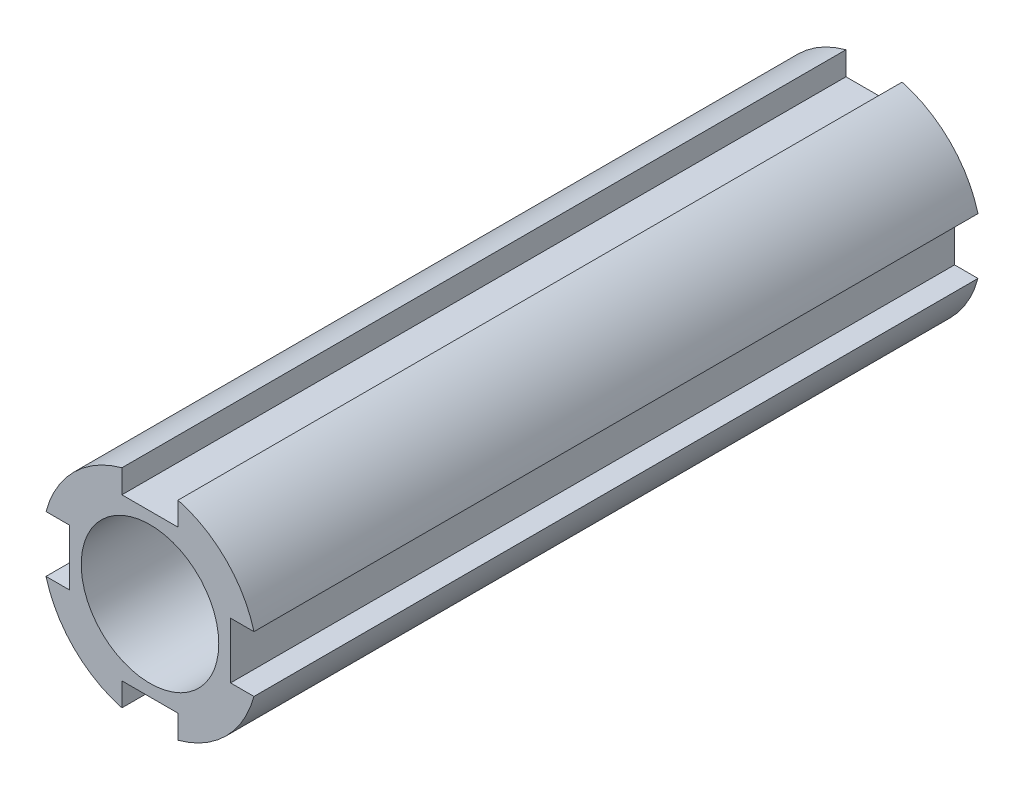
from build123d import *

# Parameters (mm, degrees)
SKETCH1_R           = 5.95
BOSS_EXTRUDE2_DEPTH = 20
CUT_EXTRUDE1_DEPTH  = 41.875481649
CUT_EXTRUDE3_DEPTH  = 41.875481649
SKETCH10_R          = 3.8
CUT_EXTRUDE4_DEPTH  = 8
FILLET2_R           = 0.25


with BuildPart() as part:
    # Sketch1 → Boss-Extrude2 (new, symmetric)
    with BuildSketch(Plane.XY):
        Circle(SKETCH1_R)
    extrude(amount=BOSS_EXTRUDE2_DEPTH, both=True)

    # Sketch8 → Cut-Extrude1 (cut, through all)
    with BuildSketch(Plane.XY.offset(20)):
        Polygon((1.1, 1.05), (2.4, 1.05), (2.4, -1.05), (1.1, -1.05), (1.1, -2.35), (-1, -2.35), (-1, -1.05), (-2.3, -1.05), (-2.3, 1.05), (-1, 1.05), (-1, 2.35), (1.1, 2.35), align=None)
    extrude(amount=-CUT_EXTRUDE1_DEPTH, mode=Mode.SUBTRACT)

    # Sketch9 → Cut-Extrude3 (cut, through all)
    with BuildSketch(Plane.XY.offset(20)):
        with BuildLine():
            ThreePointArc((1.55, 5.744562647), (0, 5.95), (-1.55, 5.744562647))
            Line((-1.55, 5.744562647), (-1.55, 4.45))
            Line((-1.55, 4.45), (1.55, 4.45))
            Line((1.55, 4.45), (1.55, 5.744562647))
        make_face()
        with BuildLine():
            ThreePointArc((5.95, 0), (5.898417065, 0.781777543), (5.744562647, 1.55))
            Line((5.744562647, 1.55), (4.45, 1.55))
            Line((4.45, 1.55), (4.45, -1.55))
            Line((4.45, -1.55), (5.744562647, -1.55))
            ThreePointArc((5.744562647, -1.55), (5.898417065, -0.781777543), (5.95, 0))
        make_face()
        with BuildLine():
            Line((-4.45, 1.55), (-5.744562647, 1.55))
            ThreePointArc((-5.744562647, 1.55), (-5.95, 0), (-5.744562647, -1.55))
            Line((-5.744562647, -1.55), (-4.45, -1.55))
            Line((-4.45, -1.55), (-4.45, 1.55))
        make_face()
        with BuildLine():
            Line((-1.55, -4.45), (-1.55, -5.744562647))
            ThreePointArc((-1.55, -5.744562647), (0, -5.95), (1.55, -5.744562647))
            Line((1.55, -5.744562647), (1.55, -4.45))
            Line((1.55, -4.45), (-1.55, -4.45))
        make_face()
    extrude(amount=-CUT_EXTRUDE3_DEPTH, mode=Mode.SUBTRACT)

    # Sketch10 → Cut-Extrude4 (cut)
    with BuildSketch(Plane.XY.offset(20)):
        Circle(SKETCH10_R)
    cut_extrude4 = extrude(amount=-CUT_EXTRUDE4_DEPTH, mode=Mode.SUBTRACT)

    # Mirror1: Cut-Extrude4 across plane
    add(cut_extrude4.mirror(Plane.XY), mode=Mode.SUBTRACT)

    # Fillet2
    fillet2_edges = [part.edges().sort_by_distance(p)[0] for p in [
        (1.1, -1.05, 0),
        (1.1, 1.05, 0),
        (-1, 1.05, 0),
        (-1, -1.05, 0),
    ]]
    fillet(fillet2_edges, radius=FILLET2_R)


solid = part.part
